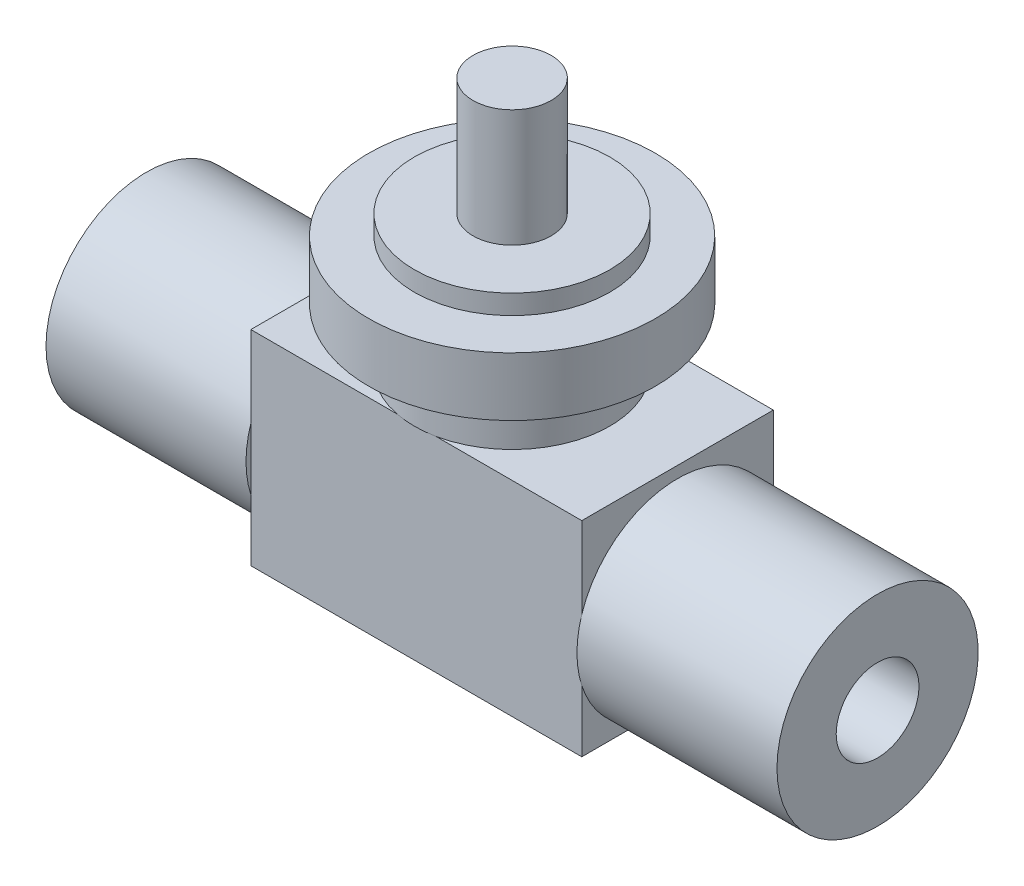
from build123d import *

# Parameters (mm, degrees)
BODY_SKETCH_W       = 25.4
BODY_SKETCH_H       = 15.7
BODY_DEPTH          = 7.35
NUT_X_SKETCH_W      = 15.35
NUT_X_SKETCH_H      = 7.722
NUT_X_SKETCH_2_W    = 15.35
NUT_X_SKETCH_2_H    = 7.722
SOCKET_X_SKETCH_W   = 16.2
SOCKET_X_SKETCH_H   = 3.175
SOCKET_X_SKETCH_2_W = 16.2
SOCKET_X_SKETCH_2_H = 3.175


with BuildPart() as part:
    # Body Sketch → Body (new, symmetric)
    with BuildSketch(Plane.XY):
        with Locations((0, 0.75)):
            Rectangle(BODY_SKETCH_W, BODY_SKETCH_H)
    extrude(amount=BODY_DEPTH, both=True)

    # Nut _X Sketch → Nut _X (revolve)
    with BuildSketch(Plane.XY):
        with Locations((20.375, 3.861)):
            Rectangle(NUT_X_SKETCH_W, NUT_X_SKETCH_H)
    revolve(axis=Axis((-1000, 0, 0), (1, 0, 0)))

    # Nut -X Sketch 2 → Nut -X 2 (revolve)
    with BuildSketch(Plane.XY):
        with Locations((-20.375, 3.861)):
            Rectangle(NUT_X_SKETCH_2_W, NUT_X_SKETCH_2_H)
    revolve(axis=Axis((-1000, 0, 0), (1, 0, 0)))

    # Socket _X Sketch → Socket _X (revolve, cut)
    with BuildSketch(Plane.XY):
        with Locations((20.95, 1.5875)):
            Rectangle(SOCKET_X_SKETCH_W, SOCKET_X_SKETCH_H)
    revolve(axis=Axis((-1000, 0, 0), (1, 0, 0)), mode=Mode.SUBTRACT)

    # Socket -X Sketch 2 → Socket -X 2 (revolve, cut)
    with BuildSketch(Plane.XY):
        with Locations((-20.95, 1.5875)):
            Rectangle(SOCKET_X_SKETCH_2_W, SOCKET_X_SKETCH_2_H)
    revolve(axis=Axis((-1000, 0, 0), (1, 0, 0)), mode=Mode.SUBTRACT)

    # Stem Sketch → Stem (revolve)
    with BuildSketch(Plane.XY):
        Polygon((0, 8.6), (7.5, 8.6), (7.5, 13), (11, 13), (11, 17.5), (7.5, 17.5), (7.5, 19), (3, 19), (3, 28), (0, 28), align=None)
    revolve(axis=Axis((0, -500, 0), (0, 1, 0)))


solid = part.part
